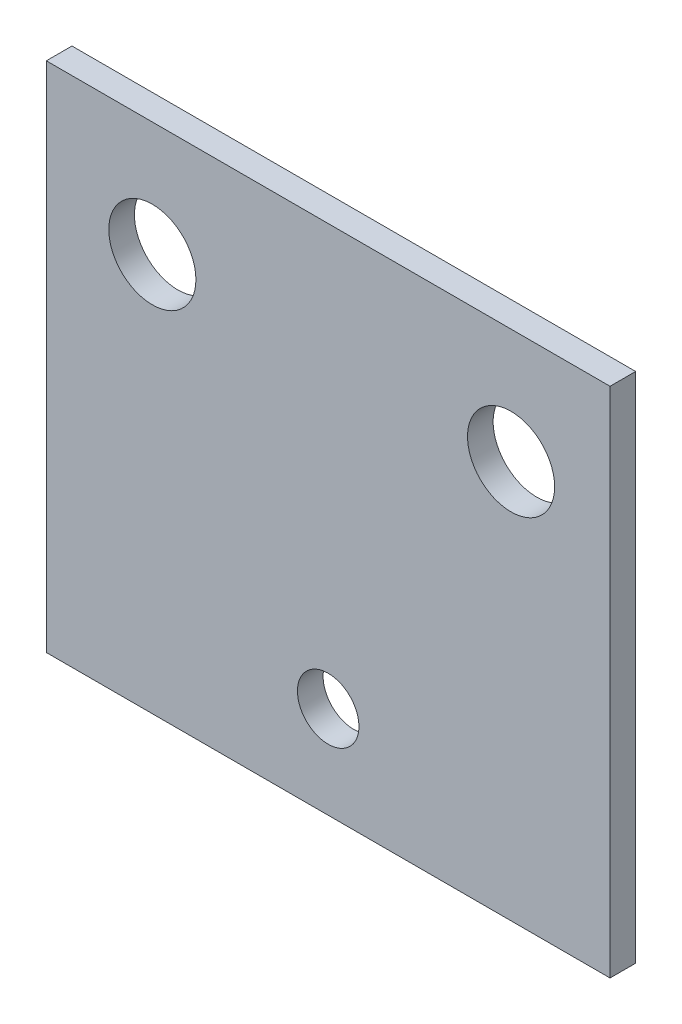
from build123d import *

# Parameters (mm, degrees)
CROQUIS1_W              = 110
CROQUIS1_H              = 100
CROQUIS1_R              = 6
CROQUIS1_R_2            = 8.5
SALIENTE_EXTRUIR1_DEPTH = 5


with BuildPart() as part:
    # Croquis1 → Saliente-Extruir1 (new body)
    with BuildSketch(Plane.XY):
        Rectangle(CROQUIS1_W, CROQUIS1_H)
        with Locations((0, -31.999654028)):
            Circle(CROQUIS1_R, mode=Mode.SUBTRACT)
        with Locations((35.687746761, 27.604087741)):
            Circle(CROQUIS1_R_2, mode=Mode.SUBTRACT)
        with Locations((-34.312253239, 27.604087741)):
            Circle(CROQUIS1_R_2, mode=Mode.SUBTRACT)
    extrude(amount=SALIENTE_EXTRUIR1_DEPTH)


solid = part.part
